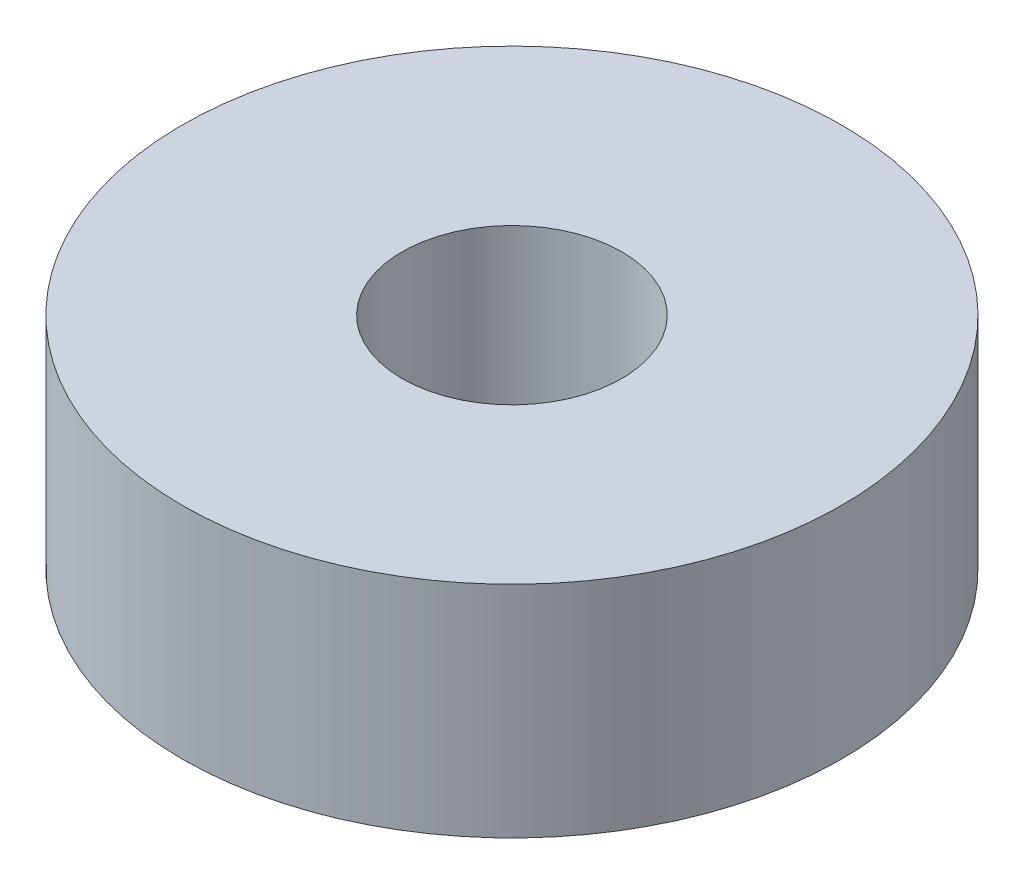
from build123d import *

# Parameters (mm, degrees)
SKETCH_1_R      = 6
SKETCH_1_R_2    = 2
EXTRUDE_1_DEPTH = 4


with BuildPart() as part:
    # 草图1 → 凸台-拉伸1 (new body)
    with BuildSketch(Plane(origin=(0, 0, 0), x_dir=(1, 0, 0), z_dir=(0, 1, 0))):
        with Locations(Location((0, 0, 0), (0, 0, 270))):
            Circle(SKETCH_1_R)
        with Locations(Location((0, 0, 0), (0, 0, 270))):
            Circle(SKETCH_1_R_2, mode=Mode.SUBTRACT)
    extrude(amount=EXTRUDE_1_DEPTH)


solid = part.part
